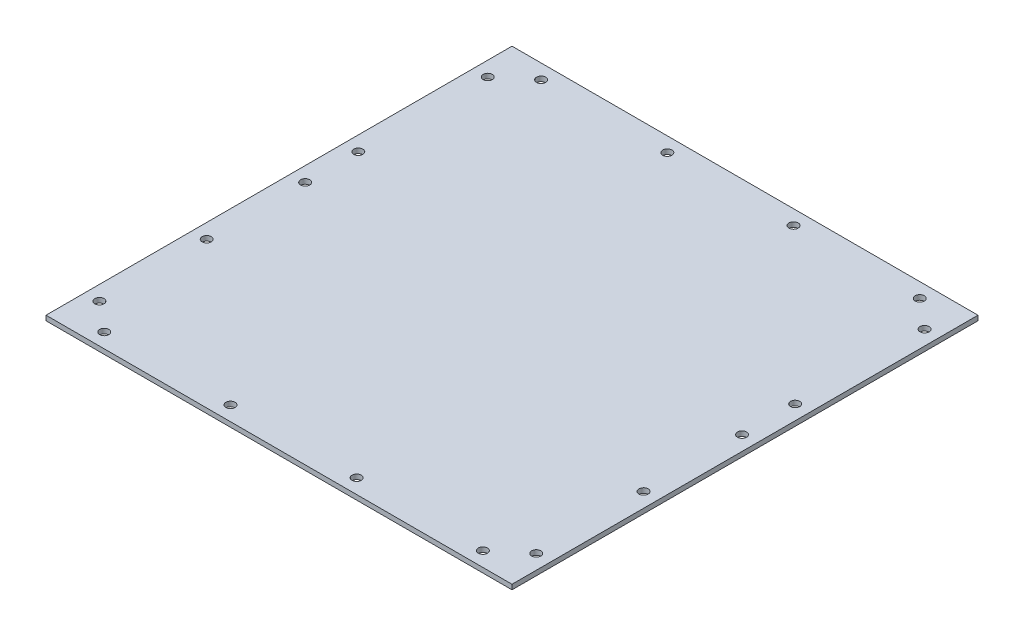
from build123d import *

# Parameters (mm, degrees)
SKETCH2_W             = 152.4
SKETCH2_H             = 152.4
BOSS_EXTRUDE1_DEPTH   = 1.5875
F_3_0MM_DOWEL_HOLE2_D = 3
F_3_0MM_DOWEL_HOLE3_D = 3
LPATTERN1_COUNT       = 4
LPATTERN1_PITCH       = 42.333333333
LPATTERN2_COUNT       = 4
LPATTERN2_PITCH       = 41.275
F_3_0MM_DOWEL_HOLE1_D = 3


with BuildPart() as part:
    # Sketch2 → Boss-Extrude1 (new body)
    with BuildSketch(Plane(origin=(0, 0, 0), x_dir=(1, 0, 0), z_dir=(0, 1, 0))):
        with Locations((76.2, 76.2)):
            Rectangle(SKETCH2_W, SKETCH2_H)
    extrude(amount=BOSS_EXTRUDE1_DEPTH)

    # Ø3.0mm Dowel Hole2 (through all)
    with Locations(Plane(origin=(0, 1.5875, 0), x_dir=(1, 0, 0), z_dir=(0, 1, 0))):
        with Locations((14.2875, 147.6375), (14.2875, 4.7625)):
            f_3_0mm_dowel_hole2 = Hole(F_3_0MM_DOWEL_HOLE2_D / 2)

    # Ø3.0mm Dowel Hole3 (through all)
    with Locations(Plane(origin=(0, 1.5875, 0), x_dir=(1, 0, 0), z_dir=(0, 1, 0))):
        with Locations((4.7625, 139.7), (147.6375, 139.7)):
            f_3_0mm_dowel_hole3 = Hole(F_3_0MM_DOWEL_HOLE3_D / 2)

    # LPattern1: Ø3.0mm Dowel Hole3 ×4, 1 skipped
    with Locations(*[(0, 0, i * LPATTERN1_PITCH) for i in range(1, LPATTERN1_COUNT) if i not in (2,)]):
        add(f_3_0mm_dowel_hole3, mode=Mode.SUBTRACT)

    # LPattern2: Ø3.0mm Dowel Hole2 ×4
    with Locations(*[(i * LPATTERN2_PITCH, 0, 0) for i in range(1, LPATTERN2_COUNT)]):
        add(f_3_0mm_dowel_hole2, mode=Mode.SUBTRACT)

    # Ø3.0mm Dowel Hole1 (through all)
    with Locations(Plane(origin=(0, 1.5875, 0), x_dir=(1, 0, 0), z_dir=(0, 1, 0))):
        with Locations((147.6375, 47.79), (147.6375, 80)):
            f_3_0mm_dowel_hole1 = Hole(F_3_0MM_DOWEL_HOLE1_D / 2)

    # Mirror1: Ø3.0mm Dowel Hole1 across plane
    add(f_3_0mm_dowel_hole1.mirror(Plane(origin=(76.2, 0, 0), x_dir=(0, 0, 1), z_dir=(1, 0, 0))), mode=Mode.SUBTRACT)


solid = part.part
